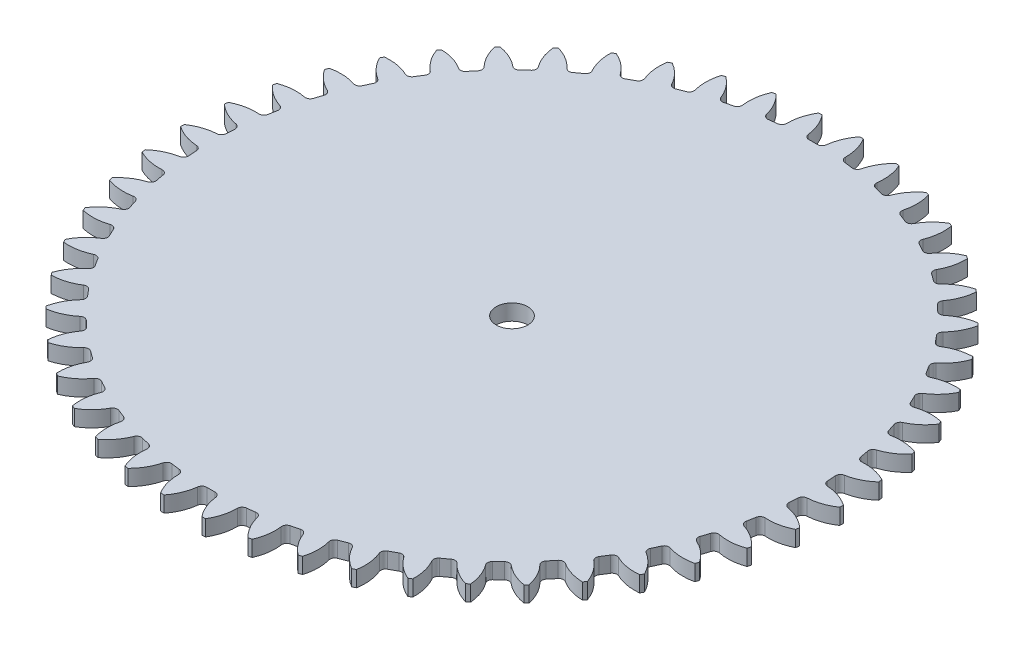
from build123d import *

# Parameters (mm, degrees)
SKETCH1_R                = 104
SKETCH1_R_2              = 5
BOSS_EXTRUDE1_DEPTH      = 5
CUT_EXTRUDE1_DEPTH       = 148.163174742
FILLET1_R                = 1.52
CIRPATTERN2_COUNT        = 50
FILLET1_OF_CIRPATTERN2_R = 1.52


with BuildPart() as part:
    # Sketch1 → Boss-Extrude1 (new body)
    with BuildSketch(Plane(origin=(0, 0, 0), x_dir=(1, 0, 0), z_dir=(0, 1, 0))):
        with Locations(Location((0, 0, 0), (0, 0, 270))):
            Circle(SKETCH1_R)
        with Locations(Location((0, 0, 0), (0, 0, 270))):
            Circle(SKETCH1_R_2, mode=Mode.SUBTRACT)
    extrude(amount=BOSS_EXTRUDE1_DEPTH)

    # Sketch2 → Cut-Extrude1 (cut, through all)
    with BuildSketch(Plane(origin=(0, 5, 0), x_dir=(1, 0, 0), z_dir=(0, 1, 0))):
        with BuildLine():
            ThreePointArc((2.73983655, 94.960482811), (0, 95), (-2.73983655, 94.960482811))
            ThreePointArc((-2.73983655, 94.960482811), (-3.637636876, 99.65519437), (-5.967584346, 103.828646996))
            ThreePointArc((-5.967584346, 103.828646996), (0, 104), (5.967584346, 103.828646996))
            ThreePointArc((5.967584346, 103.828646996), (3.637636876, 99.65519437), (2.73983655, 94.960482811))
        make_face()
    cut_extrude1 = extrude(amount=-CUT_EXTRUDE1_DEPTH, mode=Mode.SUBTRACT)

    # Fillet1
    fillet1_edges = [part.edges().sort_by_distance(p)[0] for p in [
        (-2.73983655, 2.5, -94.960482811),
        (2.73983655, 2.5, -94.960482811),
    ]]
    fillet(fillet1_edges, radius=FILLET1_R)

    # CirPattern2: Cut-Extrude1 ×50 about axis
    cirpattern2_axis = Axis((0, 0, 0), (0, 1, 0))
    for i in range(1, CIRPATTERN2_COUNT):
        add(cut_extrude1.rotate(cirpattern2_axis, i * 360 / CIRPATTERN2_COUNT), mode=Mode.SUBTRACT)

    # Fillet1 of CirPattern2
    fillet1_of_cirpattern2_edges = [part.edges().sort_by_distance(p)[0] for p in [
        (-14.619936492, 2.5, -93.868298466),
        (-9.183472251, 2.5, -94.555083615),
        (-26.269471302, 2.5, -91.295754981),
        (-20.961952209, 2.5, -92.658494266),
        (-37.504720857, 2.5, -87.283422902),
        (-32.409849658, 2.5, -89.300625111),
        (-48.14849856, 2.5, -81.894579103),
        (-43.346624417, 2.5, -84.534431752),
        (-58.032945678, 2.5, -75.21420887),
        (-53.599797016, 2.5, -78.435079906),
        (-67.002178575, 2.5, -67.347665633),
        (-63.007668796, 2.5, -71.098759995),
        (-74.914747091, 2.5, -58.419009477),
        (-71.421872001, 2.5, -62.641170167),
        (-81.645865294, 2.5, -48.569050644),
        (-78.709709619, 2.5, -53.195691665),
        (-87.089379428, 2.5, -37.953128868),
        (-84.756248097, 2.5, -42.911285328),
        (-91.159442024, 2.5, -26.738663578),
        (-89.466129912, 2.5, -31.950142387),
        (-93.791865763, 2.5, -15.10251359),
        (-92.765077414, 2.5, -20.485126615),
        (-94.94513575, 2.5, -3.228187942),
        (-94.601064229, 2.5, -8.697048159),
        (-94.601064229, 2.5, 8.697048159),
        (-94.94513575, 2.5, 3.228187942),
        (-92.765077414, 2.5, 20.485126615),
        (-93.791865763, 2.5, 15.10251359),
        (-89.466129912, 2.5, 31.950142387),
        (-91.159442024, 2.5, 26.738663578),
        (-84.756248097, 2.5, 42.911285328),
        (-87.089379428, 2.5, 37.953128868),
        (-78.709709619, 2.5, 53.195691665),
        (-81.645865294, 2.5, 48.569050644),
        (-71.421872001, 2.5, 62.641170167),
        (-74.914747091, 2.5, 58.419009477),
        (-63.007668796, 2.5, 71.098759995),
        (-67.002178575, 2.5, 67.347665633),
        (-53.599797016, 2.5, 78.435079906),
        (-58.032945678, 2.5, 75.21420887),
        (-43.346624417, 2.5, 84.534431752),
        (-48.14849856, 2.5, 81.894579103),
        (-32.409849658, 2.5, 89.300625111),
        (-37.504720857, 2.5, 87.283422902),
        (-20.961952209, 2.5, 92.658494266),
        (-26.269471302, 2.5, 91.295754981),
        (-9.183472251, 2.5, 94.555083615),
        (-14.619936492, 2.5, 93.868298466),
        (2.73983655, 2.5, 94.960482811),
        (-2.73983655, 2.5, 94.960482811),
        (14.619936492, 2.5, 93.868298466),
        (9.183472251, 2.5, 94.555083615),
        (26.269471302, 2.5, 91.295754981),
        (20.961952209, 2.5, 92.658494266),
        (37.504720857, 2.5, 87.283422902),
        (32.409849658, 2.5, 89.300625111),
        (48.14849856, 2.5, 81.894579103),
        (43.346624417, 2.5, 84.534431752),
        (58.032945678, 2.5, 75.21420887),
        (53.599797016, 2.5, 78.435079906),
        (67.002178575, 2.5, 67.347665633),
        (63.007668796, 2.5, 71.098759995),
        (74.914747091, 2.5, 58.419009477),
        (71.421872001, 2.5, 62.641170167),
        (81.645865294, 2.5, 48.569050644),
        (78.709709619, 2.5, 53.195691665),
        (87.089379428, 2.5, 37.953128868),
        (84.756248097, 2.5, 42.911285328),
        (91.159442024, 2.5, 26.738663578),
        (89.466129912, 2.5, 31.950142387),
        (93.791865763, 2.5, 15.10251359),
        (92.765077414, 2.5, 20.485126615),
        (94.94513575, 2.5, 3.228187942),
        (94.601064229, 2.5, 8.697048159),
        (94.601064229, 2.5, -8.697048159),
        (94.94513575, 2.5, -3.228187942),
        (92.765077414, 2.5, -20.485126615),
        (93.791865763, 2.5, -15.10251359),
        (89.466129912, 2.5, -31.950142387),
        (91.159442024, 2.5, -26.738663578),
        (84.756248097, 2.5, -42.911285328),
        (87.089379428, 2.5, -37.953128868),
        (78.709709619, 2.5, -53.195691665),
        (81.645865294, 2.5, -48.569050644),
        (71.421872001, 2.5, -62.641170167),
        (74.914747091, 2.5, -58.419009477),
        (63.007668796, 2.5, -71.098759995),
        (67.002178575, 2.5, -67.347665633),
        (53.599797016, 2.5, -78.435079906),
        (58.032945678, 2.5, -75.21420887),
        (43.346624417, 2.5, -84.534431752),
        (48.14849856, 2.5, -81.894579103),
        (32.409849658, 2.5, -89.300625111),
        (37.504720857, 2.5, -87.283422902),
        (20.961952209, 2.5, -92.658494266),
        (26.269471302, 2.5, -91.295754981),
        (9.183472251, 2.5, -94.555083615),
        (14.619936492, 2.5, -93.868298466),
    ]]
    fillet(fillet1_of_cirpattern2_edges, radius=FILLET1_OF_CIRPATTERN2_R)


solid = part.part
